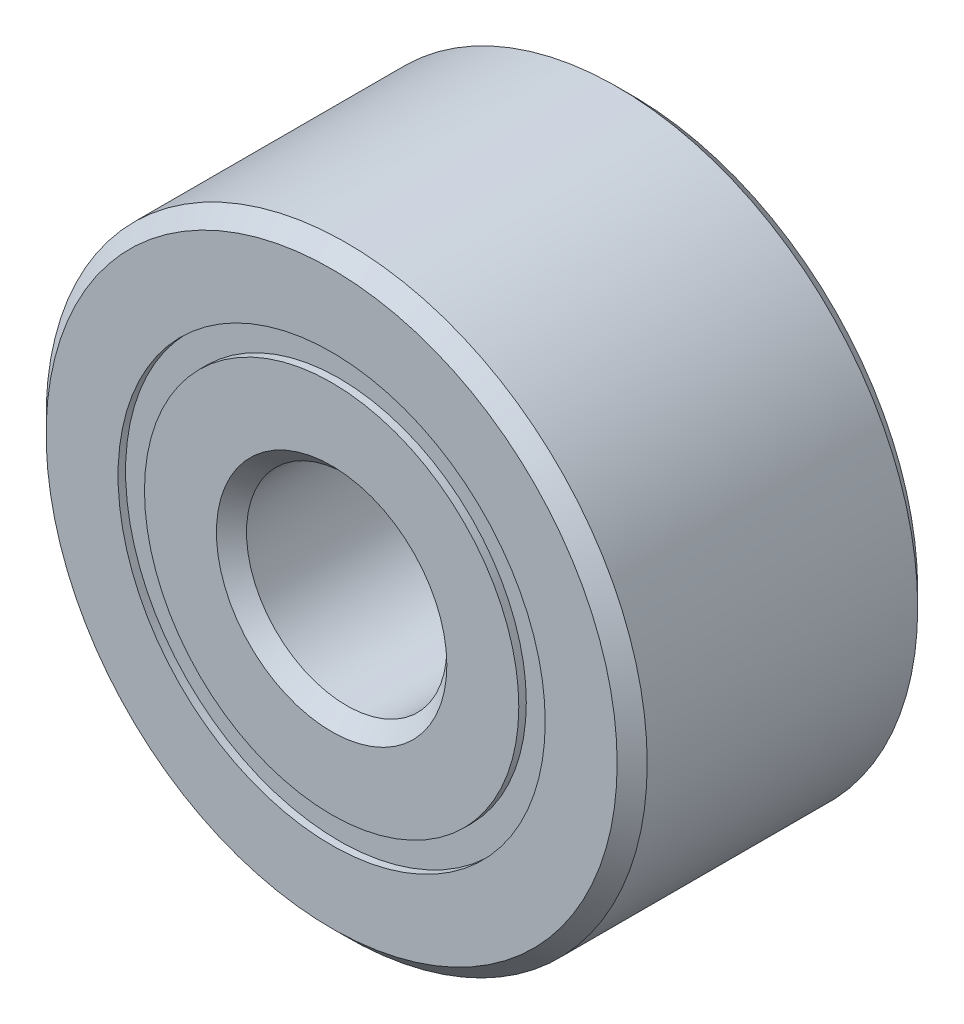
from build123d import *

# Parameters (mm, degrees)
CIRPATTERN1_COUNT = 12
SKETCH5_W         = 0.745416562
SKETCH5_H         = 0.263736264


with BuildPart() as part:
    # Sketch1 → Revolve1 (revolve)
    with BuildSketch(Plane(origin=(0, 0, 0), x_dir=(0, 0, -1), z_dir=(1, 0, 0))):
        with BuildLine():
            Line((1.35, 3), (-1.35, 3))
            Line((-1.35, 3), (-1.5, 2.85))
            Line((-1.5, 2.85), (-1.5, 2.131868132))
            Line((-1.5, 2.131868132), (-0.666666667, 2.131868132))
            ThreePointArc((-0.666666667, 2.131868132), (0, 2.679583438), (0.666666667, 2.131868132))
            Line((0.666666667, 2.131868132), (1.5, 2.131868132))
            Line((1.5, 2.131868132), (1.5, 2.85))
            Line((1.5, 2.85), (1.35, 3))
        make_face()
    revolve(axis=Axis((0, 0, 1.5), (0, 0, -1)))


with BuildPart() as body_2:
    # Sketch3 → Revolve3 (revolve)
    with BuildSketch(Plane(origin=(0, 0, 0), x_dir=(0, 0, -1), z_dir=(1, 0, 0))):
        with BuildLine():
            Line((-1.5, 1.868131868), (-0.666666667, 1.868131868))
            ThreePointArc((-0.666666667, 1.868131868), (0, 1.320416562), (0.666666667, 1.868131868))
            Line((0.666666667, 1.868131868), (1.5, 1.868131868))
            Line((1.5, 1.868131868), (1.5, 1.15))
            Line((1.5, 1.15), (1.35, 1))
            Line((1.35, 1), (-1.35, 1))
            Line((-1.35, 1), (-1.5, 1.15))
            Line((-1.5, 1.15), (-1.5, 1.868131868))
        make_face()
    revolve(axis=Axis((0, 0, 1.5), (0, 0, -1)))


with BuildPart() as body_3:
    # Sketch4 → Revolve4 (revolve)
    with BuildSketch(Plane(origin=(0, 0, 0), x_dir=(0, 0, -1), z_dir=(1, 0, 0))):
        with BuildLine():
            Line((-0.679583438, 2), (0.679583438, 2))
            ThreePointArc((0.679583438, 2), (0, 2.679583438), (-0.679583438, 2))
        make_face()
    revolve(axis=Axis((0, 2, 0.679583438), (0, 0, -1)))


with BuildPart() as cirpattern1_1:
    # CirPattern1: pattern copy
    add(body_3.part.rotate(Axis((0, 0, -1.5), (0, 0, 1)), 1 * 360 / CIRPATTERN1_COUNT))


with BuildPart() as cirpattern1_2:
    # CirPattern1: pattern copy
    add(body_3.part.rotate(Axis((0, 0, -1.5), (0, 0, 1)), 2 * 360 / CIRPATTERN1_COUNT))


with BuildPart() as cirpattern1_3:
    # CirPattern1: pattern copy
    add(body_3.part.rotate(Axis((0, 0, -1.5), (0, 0, 1)), 3 * 360 / CIRPATTERN1_COUNT))


with BuildPart() as cirpattern1_4:
    # CirPattern1: pattern copy
    add(body_3.part.rotate(Axis((0, 0, -1.5), (0, 0, 1)), 4 * 360 / CIRPATTERN1_COUNT))


with BuildPart() as cirpattern1_5:
    # CirPattern1: pattern copy
    add(body_3.part.rotate(Axis((0, 0, -1.5), (0, 0, 1)), 5 * 360 / CIRPATTERN1_COUNT))


with BuildPart() as cirpattern1_6:
    # CirPattern1: pattern copy
    add(body_3.part.rotate(Axis((0, 0, -1.5), (0, 0, 1)), 6 * 360 / CIRPATTERN1_COUNT))


with BuildPart() as cirpattern1_7:
    # CirPattern1: pattern copy
    add(body_3.part.rotate(Axis((0, 0, -1.5), (0, 0, 1)), 7 * 360 / CIRPATTERN1_COUNT))


with BuildPart() as cirpattern1_8:
    # CirPattern1: pattern copy
    add(body_3.part.rotate(Axis((0, 0, -1.5), (0, 0, 1)), 8 * 360 / CIRPATTERN1_COUNT))


with BuildPart() as cirpattern1_9:
    # CirPattern1: pattern copy
    add(body_3.part.rotate(Axis((0, 0, -1.5), (0, 0, 1)), 9 * 360 / CIRPATTERN1_COUNT))


with BuildPart() as cirpattern1_10:
    # CirPattern1: pattern copy
    add(body_3.part.rotate(Axis((0, 0, -1.5), (0, 0, 1)), 10 * 360 / CIRPATTERN1_COUNT))


with BuildPart() as cirpattern1_11:
    # CirPattern1: pattern copy
    add(body_3.part.rotate(Axis((0, 0, -1.5), (0, 0, 1)), 11 * 360 / CIRPATTERN1_COUNT))


with BuildPart() as body_15:
    # Sketch5 → Revolve5 (revolve)
    with BuildSketch(Plane(origin=(0, 0, 0), x_dir=(0, 0, -1), z_dir=(1, 0, 0))):
        with Locations((-1.052291719, 2)):
            Rectangle(SKETCH5_W, SKETCH5_H)
        with Locations((1.052291719, 2)):
            Rectangle(SKETCH5_W, SKETCH5_H)
    revolve(axis=Axis((0, 0, 1.5), (0, 0, -1)))


solid = Compound([part.part, body_2.part, body_3.part, cirpattern1_1.part, cirpattern1_2.part, cirpattern1_3.part, cirpattern1_4.part, cirpattern1_5.part, cirpattern1_6.part, cirpattern1_7.part, cirpattern1_8.part, cirpattern1_9.part, cirpattern1_10.part, cirpattern1_11.part, body_15.part])
